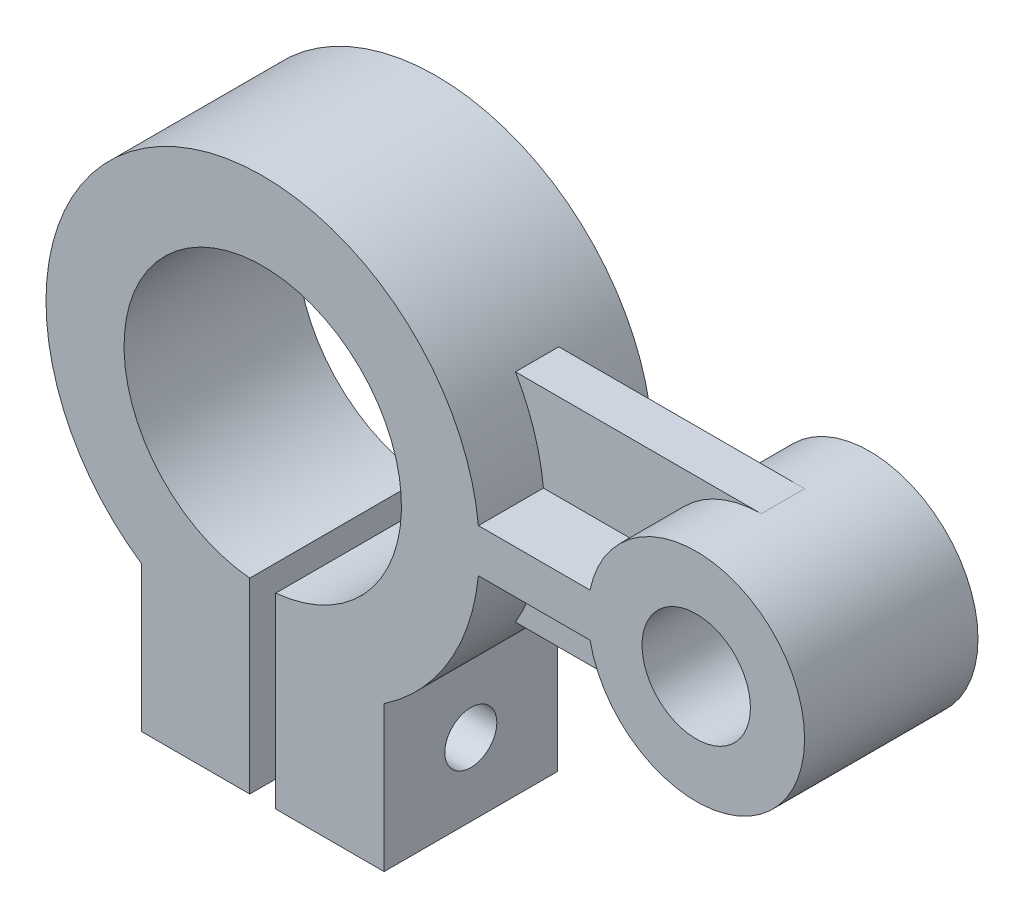
from build123d import *

# Parameters (mm, degrees)
SKETCH1_R                = 12.5
BOSS_EXTRUDE1_DEPTH      = 20
SKETCH2_R                = 6
CUT_EXTRUDE2_DEPTH       = 56
BOSS_EXTRUDE2_DEPTH      = 5
BOSS_EXTRUDE2_DEPTH_BACK = 5


with BuildPart() as part:
    # Sketch1 → Boss-Extrude1 (new, symmetric)
    with BuildSketch(Plane.XY):
        with BuildLine():
            Line((-68.381118609, -39.565472128), (-68.381118609, 3.575463228))
            ThreePointArc((-68.381118609, 3.575463228), (-65.381118609, 67.434527872), (-62.381118609, 3.575463228))
            Line((-62.381118609, 3.575463228), (-62.381118609, -39.565472128))
            Line((-62.381118609, -39.565472128), (-37.381118609, -39.565472128))
            Line((-37.381118609, -39.565472128), (-37.381118609, -5.990102483))
            ThreePointArc((-37.381118609, -5.990102483), (-22.451762335, 9.801143977), (-15.631746753, 30.434527872))
            Line((-15.631746753, 30.434527872), (10.123983964, 30.434527872))
            ThreePointArc((10.123983964, 30.434527872), (59.618881391, 35.434527872), (10.123983964, 40.434527872))
            Line((10.123983964, 40.434527872), (-15.631746753, 40.434527872))
            ThreePointArc((-15.631746753, 40.434527872), (-91.014502504, 78.363884146), (-93.381118609, -5.990102483))
            Line((-93.381118609, -5.990102483), (-93.381118609, -39.565472128))
            Line((-93.381118609, -39.565472128), (-68.381118609, -39.565472128))
        make_face()
        with Locations((34.618881391, 35.434527872)):
            Circle(SKETCH1_R, mode=Mode.SUBTRACT)
    extrude(amount=BOSS_EXTRUDE1_DEPTH, both=True)

    # Sketch2 → Cut-Extrude2 (cut)
    with BuildSketch(Plane(origin=(-37.381118609, 0, 0), x_dir=(0, 0, -1), z_dir=(1, 0, 0))):
        with Locations((0, -22.777787305)):
            Circle(SKETCH2_R)
    extrude(amount=-CUT_EXTRUDE2_DEPTH, mode=Mode.SUBTRACT)

    # Sketch7 → Boss-Extrude2 (add, two sides: drawn at the far end of the back side and taken through both)
    with BuildSketch(Plane.XY.offset(-BOSS_EXTRUDE2_DEPTH_BACK)):
        with BuildLine():
            ThreePointArc((10.123983964, 40.434527872), (18.807493091, 54.799444603), (34.618881391, 60.434527872))
            Line((34.618881391, 60.434527872), (-22.079848419, 60.434527872))
            ThreePointArc((-22.079848419, 60.434527872), (-17.793247294, 50.777099487), (-15.631746753, 40.434527872))
            Line((-15.631746753, 40.434527872), (10.123983964, 40.434527872))
        make_face()
        with BuildLine():
            Line((-22.079848419, 10.434527872), (34.618881391, 10.434527872))
            ThreePointArc((34.618881391, 10.434527872), (18.807493091, 16.069611141), (10.123983964, 30.434527872))
            Line((10.123983964, 30.434527872), (-15.631746753, 30.434527872))
            ThreePointArc((-15.631746753, 30.434527872), (-17.793247294, 20.091956256), (-22.079848419, 10.434527872))
        make_face()
    extrude(amount=BOSS_EXTRUDE2_DEPTH + BOSS_EXTRUDE2_DEPTH_BACK)


solid = part.part
